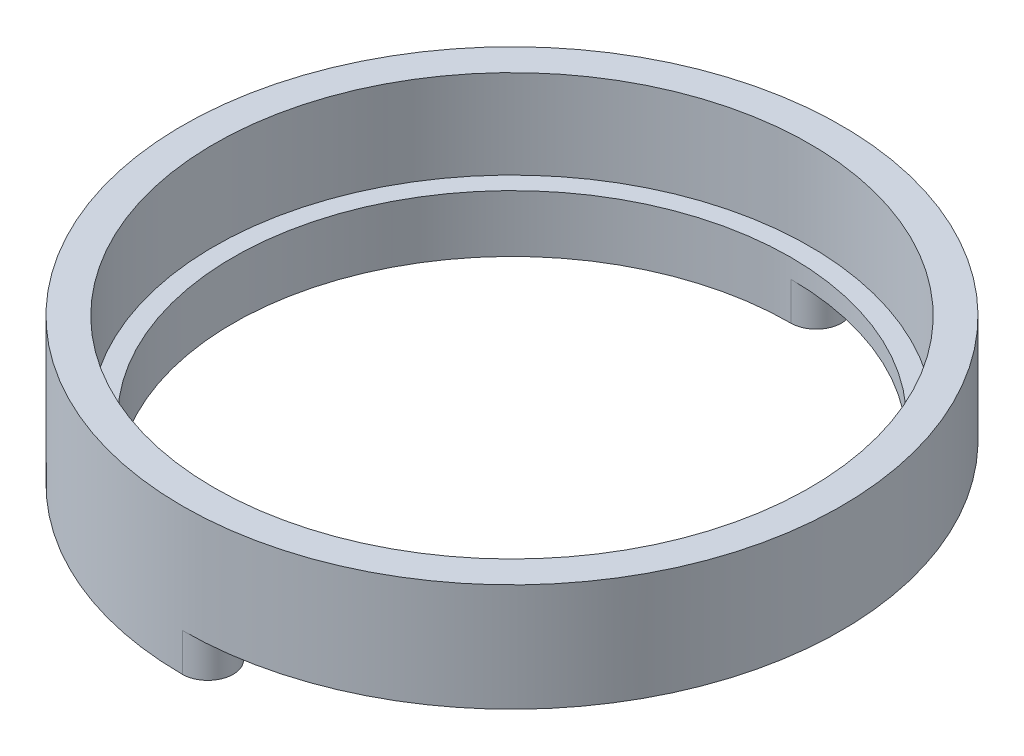
from build123d import *

# Parameters (mm, degrees)
SKETCH1_R           = 23.5
SKETCH1_R_2         = 22
BOSS_EXTRUDE1_DEPTH = 1.5
SKETCH2_R           = 26
SKETCH2_R_2         = 23.5
BOSS_EXTRUDE2_DEPTH = 8.5
BOSS_EXTRUDE3_START = 3
BOSS_EXTRUDE3_DEPTH = 3


with BuildPart() as part:
    # Sketch1 → Boss-Extrude1 (new body)
    with BuildSketch(Plane(origin=(0, 0, 0), x_dir=(1, 0, 0), z_dir=(0, 1, 0))):
        with Locations(Location((0, 0, 0), (0, 0, 270))):
            Circle(SKETCH1_R)
        with Locations(Location((0, 0, 0), (0, 0, 270))):
            Circle(SKETCH1_R_2, mode=Mode.SUBTRACT)
    extrude(amount=BOSS_EXTRUDE1_DEPTH)

    # Sketch2 → Boss-Extrude2 (add)
    with BuildSketch(Plane(origin=(0, 0, 0), x_dir=(1, 0, 0), z_dir=(0, 1, 0))):
        with Locations(Location((0, 0, 0), (0, 0, 270))):
            Circle(SKETCH2_R)
        with Locations(Location((0, 0, 0), (0, 0, 270))):
            Circle(SKETCH2_R_2, mode=Mode.SUBTRACT)
    extrude(amount=BOSS_EXTRUDE2_DEPTH)

    # Sketch3 → Boss-Extrude3 (add)
    with BuildSketch(Plane.XZ.offset(BOSS_EXTRUDE3_START)):
        with BuildLine():
            ThreePointArc((0, 26), (-26, 0), (0, -26))
            ThreePointArc((0, -26), (2, -24), (0, -22))
            ThreePointArc((0, -22), (-22, 0), (0, 22))
            ThreePointArc((0, 22), (2, 24), (0, 26))
        make_face()
    extrude(amount=-BOSS_EXTRUDE3_DEPTH)


solid = part.part
